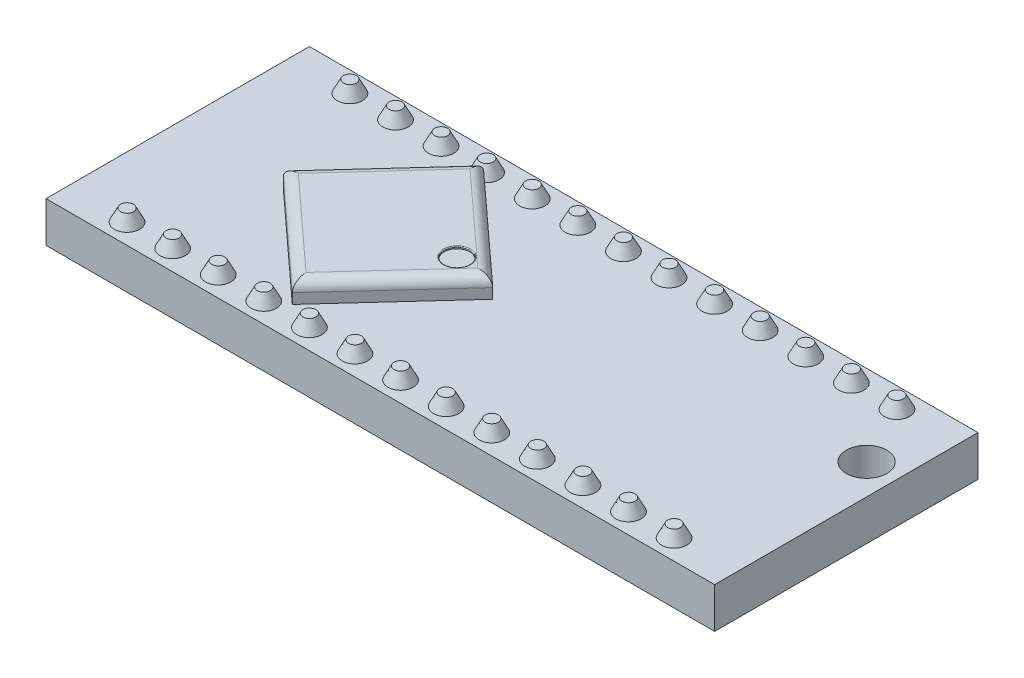
from build123d import *

# Parameters (mm, degrees)
SKETCH1_W           = 33
SKETCH1_H           = 13
BOSS_EXTRUDE1_DEPTH = 2
BOSS_EXTRUDE2_DEPTH = 1
FILLET1_R           = 0.5
SKETCH3_R           = 0.631168426
CUT_EXTRUDE1_DEPTH  = 0.1
FILLET2_R           = 0.04
SKETCH4_R           = 0.625
BOSS_EXTRUDE3_DEPTH = 0.6
BOSS_EXTRUDE3_TAPER = 27
SKETCH7_R           = 1
CUT_EXTRUDE2_DEPTH  = 3


with BuildPart() as part:
    # Sketch1 → Boss-Extrude1 (new body)
    with BuildSketch(Plane(origin=(0, 0, 0), x_dir=(1, 0, 0), z_dir=(0, 1, 0))):
        Rectangle(SKETCH1_W, SKETCH1_H)
    extrude(amount=BOSS_EXTRUDE1_DEPTH)

    # Sketch2 → Boss-Extrude2 (add)
    with BuildSketch(Plane(origin=(0, 2, 0), x_dir=(1, 0, 0), z_dir=(0, 1, 0))):
        Polygon((-11.063698409, -0.221797323), (-5.897125464, -4.944775622), (-1.174147166, 0.221797323), (-6.340720111, 4.944775622), align=None)
    extrude(amount=BOSS_EXTRUDE2_DEPTH)

    # Fillet1
    fillet1_edges = [part.edges().sort_by_distance(p)[0] for p in [
        (-8.70220926, 3, -2.361489149),
        (-8.480411937, 3, 2.583286472),
        (-3.535636315, 3, 2.361489149),
        (-3.757433638, 3, -2.583286472),
    ]]
    fillet(fillet1_edges, radius=FILLET1_R)

    # Sketch3 → Cut-Extrude1 (cut)
    with BuildSketch(Plane(origin=(0, 3, 0), x_dir=(1, 0, 0), z_dir=(0, 1, 0))):
        with Locations(Location((-2.868853152, 0.151489879, 0), (0, 0, 270))):
            Circle(SKETCH3_R)
    extrude(amount=-CUT_EXTRUDE1_DEPTH, mode=Mode.SUBTRACT)

    # Fillet2
    fillet2_edges = [part.edges().sort_by_distance(p)[0] for p in [
        (-2.868853152, 3, -0.782658305),
    ]]
    fillet(fillet2_edges, radius=FILLET2_R)

    # Sketch4 → Boss-Extrude3 (add)
    with BuildSketch(Plane(origin=(0, 2, 0), x_dir=(1, 0, 0), z_dir=(0, 1, 0))):
        with Locations((-13.5, 5.5)):
            Circle(SKETCH4_R)
        with Locations((-11.25, 5.5)):
            Circle(SKETCH4_R)
        with Locations((-9, 5.5)):
            Circle(SKETCH4_R)
        with Locations((-6.75, 5.5)):
            Circle(SKETCH4_R)
        with Locations((-4.5, 5.5)):
            Circle(SKETCH4_R)
        with Locations((-2.25, 5.5)):
            Circle(SKETCH4_R)
        with Locations((0, 5.5)):
            Circle(SKETCH4_R)
        with Locations((2.25, 5.5)):
            Circle(SKETCH4_R)
        with Locations((4.5, 5.5)):
            Circle(SKETCH4_R)
        with Locations((6.75, 5.5)):
            Circle(SKETCH4_R)
        with Locations((9, 5.5)):
            Circle(SKETCH4_R)
        with Locations((11.25, 5.5)):
            Circle(SKETCH4_R)
        with Locations((13.5, 5.5)):
            Circle(SKETCH4_R)
        with Locations((-13.5, -5.5)):
            Circle(SKETCH4_R)
        with Locations((-11.25, -5.5)):
            Circle(SKETCH4_R)
        with Locations((-9, -5.5)):
            Circle(SKETCH4_R)
        with Locations((-6.75, -5.5)):
            Circle(SKETCH4_R)
        with Locations((-4.5, -5.5)):
            Circle(SKETCH4_R)
        with Locations((-2.25, -5.5)):
            Circle(SKETCH4_R)
        with Locations((0, -5.5)):
            Circle(SKETCH4_R)
        with Locations((2.25, -5.5)):
            Circle(SKETCH4_R)
        with Locations((4.5, -5.5)):
            Circle(SKETCH4_R)
        with Locations((6.75, -5.5)):
            Circle(SKETCH4_R)
        with Locations((9, -5.5)):
            Circle(SKETCH4_R)
        with Locations((11.25, -5.5)):
            Circle(SKETCH4_R)
        with Locations((13.5, -5.5)):
            Circle(SKETCH4_R)
    extrude(amount=BOSS_EXTRUDE3_DEPTH, taper=BOSS_EXTRUDE3_TAPER)

    # Sketch7 → Cut-Extrude2 (cut)
    with BuildSketch(Plane(origin=(0, 2, 0), x_dir=(1, 0, 0), z_dir=(0, 1, 0))):
        with Locations(Location((15, 2.5, 0), (0, 0, 270))):
            Circle(SKETCH7_R)
    extrude(amount=-CUT_EXTRUDE2_DEPTH, mode=Mode.SUBTRACT)


solid = part.part
